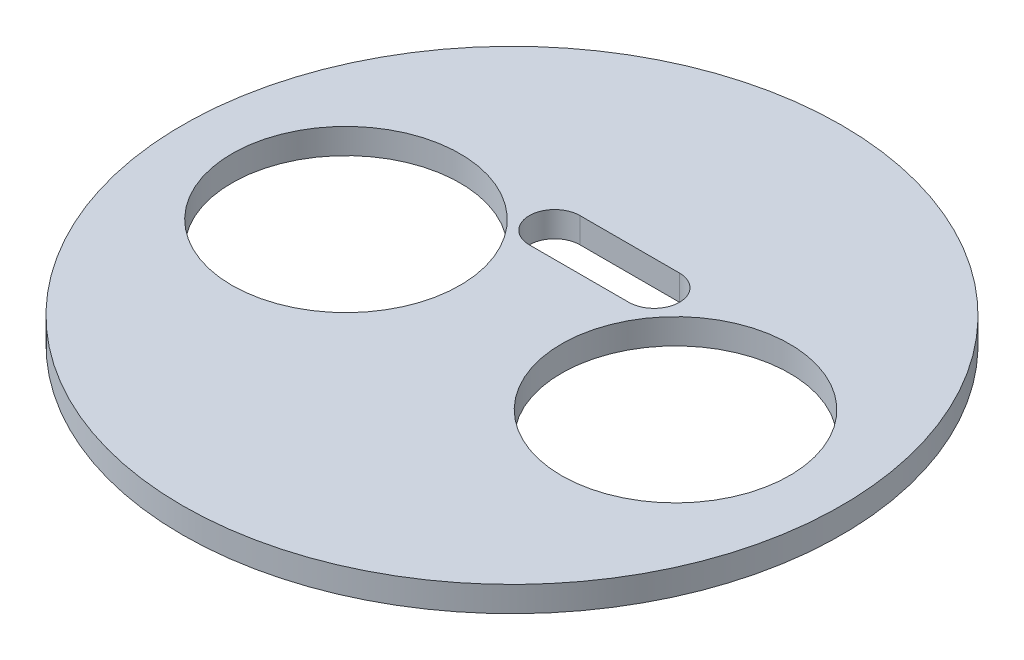
from build123d import *

# Parameters (mm, degrees)
SKETCH1_R           = 26
SKETCH1_R_2         = 9
BOSS_EXTRUDE1_DEPTH = 2


with BuildPart() as part:
    # Sketch1 → Boss-Extrude1 (new body)
    with BuildSketch(Plane(origin=(0, 0, 0), x_dir=(1, 0, 0), z_dir=(0, 1, 0))):
        with Locations(Location((-0.344405321, 0.81125846, 0), (0, 0, 270))):
            Circle(SKETCH1_R)
        with Locations(Location((12.557190609, 0.81125846, 0), (0, 0, 270))):
            Circle(SKETCH1_R_2, mode=Mode.SUBTRACT)
        with Locations(Location((-13.442809391, 0.81125846, 0), (0, 0, 270))):
            Circle(SKETCH1_R_2, mode=Mode.SUBTRACT)
        with BuildLine():
            Line((-4.479671933, 10.31125846), (3.371060839, 10.31125846))
            ThreePointArc((3.371060839, 10.31125846), (5.371060839, 8.31125846), (3.371060839, 6.31125846))
            Line((3.371060839, 6.31125846), (-4.479671933, 6.31125846))
            ThreePointArc((-4.479671933, 6.31125846), (-6.479671933, 8.31125846), (-4.479671933, 10.31125846))
        make_face(mode=Mode.SUBTRACT)
    extrude(amount=BOSS_EXTRUDE1_DEPTH)


solid = part.part
